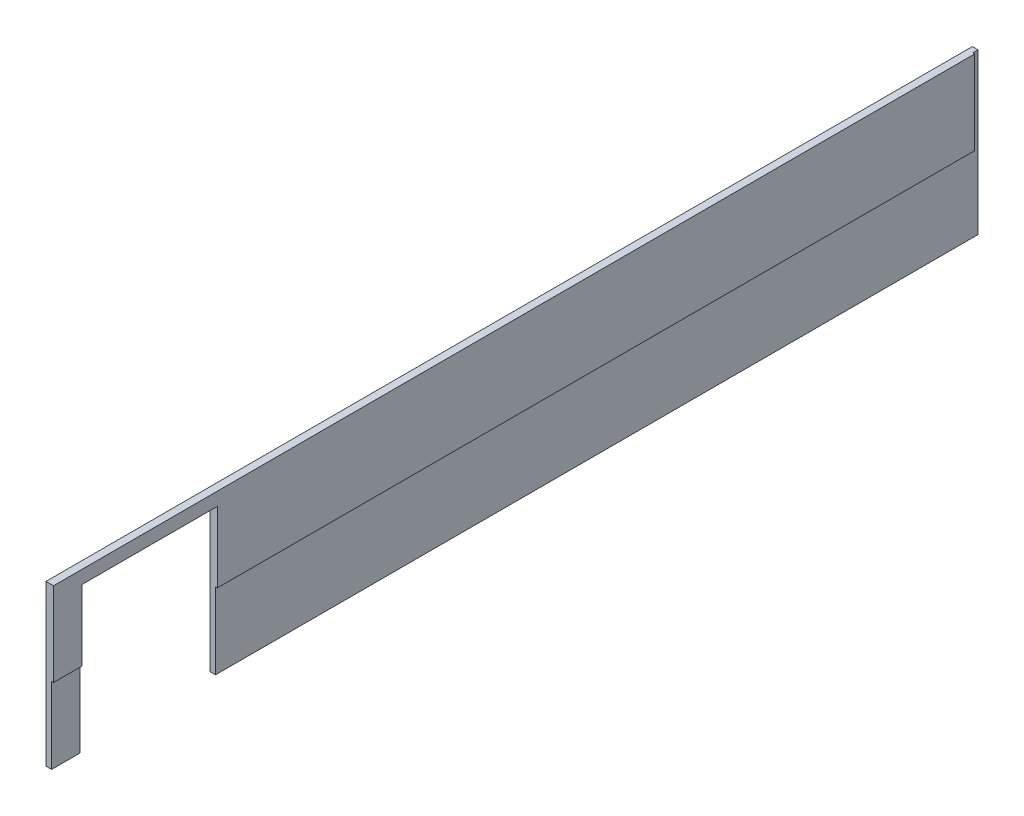
from build123d import *

# Parameters (mm, degrees)
SKETCH1_W           = 12496.8
SKETCH1_H           = 2159
BOSS_EXTRUDE1_DEPTH = 76.2
SKETCH3_W           = 12426.875050424
SKETCH3_H           = 1130.3
BOSS_EXTRUDE2_DEPTH = 25.4
SKETCH2_W           = 1828.8
SKETCH2_H           = 1981.2
CUT_EXTRUDE1_DEPTH  = 12683.334714082


with BuildPart() as part:
    # Sketch1 → Boss-Extrude1 (new body)
    with BuildSketch(Plane(origin=(0, 0, 0), x_dir=(0, 0, -1), z_dir=(1, 0, 0))):
        with Locations((6248.4, 1079.5)):
            Rectangle(SKETCH1_W, SKETCH1_H)
    extrude(amount=BOSS_EXTRUDE1_DEPTH)

    # Sketch3 → Boss-Extrude2 (add)
    with BuildSketch(Plane(origin=(76.2, 0, 0), x_dir=(0, 0, -1), z_dir=(1, 0, 0))):
        with Locations((6213.437525212, 1593.85)):
            Rectangle(SKETCH3_W, SKETCH3_H)
    extrude(amount=BOSS_EXTRUDE2_DEPTH)

    # Sketch2 → Cut-Extrude1 (cut, through all)
    with BuildSketch(Plane.ZY):
        with Locations((-1295.4, 990.6)):
            Rectangle(SKETCH2_W, SKETCH2_H)
    extrude(amount=-CUT_EXTRUDE1_DEPTH, mode=Mode.SUBTRACT)


solid = part.part
